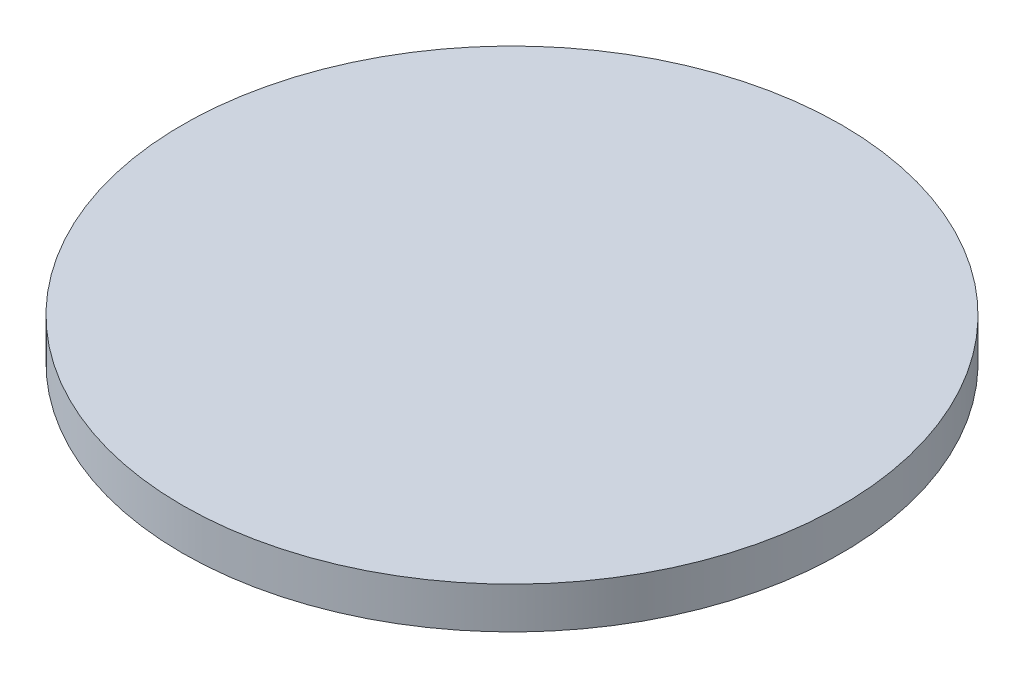
from build123d import *

# Parameters (mm, degrees)
SKETCH2_R           = 23.875
BOSS_EXTRUDE1_DEPTH = 3


with BuildPart() as part:
    # Sketch2 → Boss-Extrude1 (new body)
    with BuildSketch(Plane(origin=(0, 0, 0), x_dir=(1, 0, 0), z_dir=(0, 1, 0))):
        with Locations(Location((0, 0, 0), (0, 0, 270))):
            Circle(SKETCH2_R)
    extrude(amount=BOSS_EXTRUDE1_DEPTH)


solid = part.part
